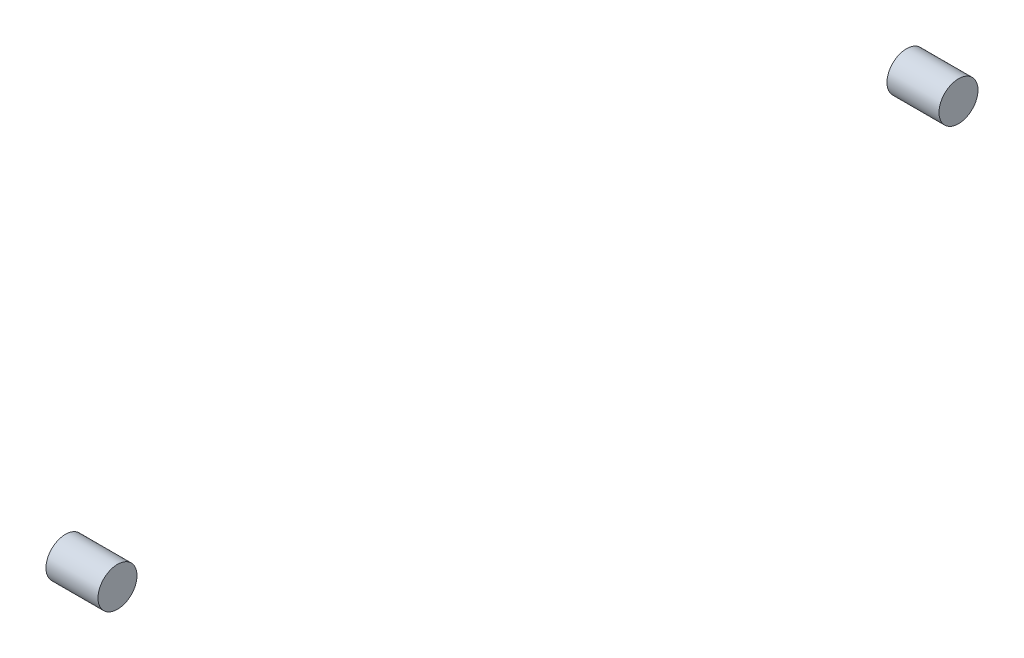
from build123d import *

# Parameters (mm, degrees)
BOSS_EXTRUDE1_START = -1170
SKETCH1_R           = 90
BOSS_EXTRUDE1_DEPTH = 240
BOSS_EXTRUDE2_START = -1170
SKETCH2_R           = 90
BOSS_EXTRUDE2_DEPTH = 240


with BuildPart() as part:
    # Sketch1 → Boss-Extrude1 (new body)
    with BuildSketch(Plane(origin=(0, 0, 0), x_dir=(0, 0, -1), z_dir=(1, 0, 0)).offset(BOSS_EXTRUDE1_START)):
        with Locations((1940, -80)):
            Circle(SKETCH1_R)
    extrude(amount=BOSS_EXTRUDE1_DEPTH)


with BuildPart() as body_2:
    # Sketch2 → Boss-Extrude2 (new body)
    with BuildSketch(Plane(origin=(0, 0, 0), x_dir=(0, 0, -1), z_dir=(1, 0, 0)).offset(BOSS_EXTRUDE2_START)):
        with Locations((-1940, -80)):
            Circle(SKETCH2_R)
    extrude(amount=BOSS_EXTRUDE2_DEPTH)


solid = Compound([part.part, body_2.part])
